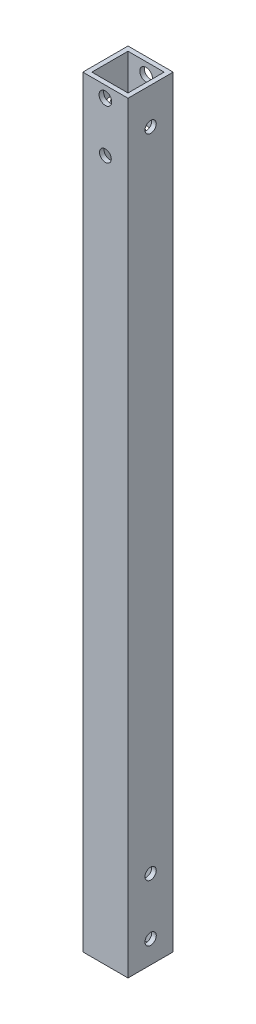
from build123d import *

# Parameters (mm, degrees)
ESBO_O1_W             = 20
ESBO_O1_H             = 20
ESBO_O1_W_2           = 16
ESBO_O1_H_2           = 16
EXTRUS_O_FINA1_DEPTH  = 337
ESBO_O2_R             = 2.5
CORTE_EXTRUS_O1_DEPTH = 339.18486069
ESBO_O3_R             = 2.6
ESBO_O3_R_2           = 2.8
CORTE_EXTRUS_O2_DEPTH = 339.18486069
ESBO_O4_R             = 2.5
CORTE_EXTRUS_O3_DEPTH = 339.18486069


with BuildPart() as part:
    # Esboço1 → Extrusão-Fina1 (new body)
    with BuildSketch(Plane(origin=(0, 0, 0), x_dir=(1, 0, 0), z_dir=(0, 1, 0))):
        with Locations((10, 10)):
            Rectangle(ESBO_O1_W, ESBO_O1_H)
        with Locations((10, 10)):
            Rectangle(ESBO_O1_W_2, ESBO_O1_H_2, mode=Mode.SUBTRACT)
    extrude(amount=EXTRUS_O_FINA1_DEPTH)

    # Esboço2 → Corte-extrusão1 (cut, through all)
    with BuildSketch(Plane.ZY):
        with Locations((-10, 35)):
            Circle(ESBO_O2_R)
        with Locations((-10, 10)):
            Circle(ESBO_O2_R)
    extrude(amount=-CORTE_EXTRUS_O1_DEPTH, mode=Mode.SUBTRACT)

    # Esboço3 → Corte-extrusão2 (cut, through all)
    with BuildSketch(Plane(origin=(0, 0, -20), x_dir=(-1, 0, 0), z_dir=(0, 0, -1))):
        with Locations((-10, 310)):
            Circle(ESBO_O3_R)
        with Locations((-10, 332)):
            Circle(ESBO_O3_R_2)
    extrude(amount=-CORTE_EXTRUS_O2_DEPTH, mode=Mode.SUBTRACT)

    # Esboço4 → Corte-extrusão3 (cut, through all)
    with BuildSketch(Plane(origin=(20, 0, 0), x_dir=(0, 0, -1), z_dir=(1, 0, 0))):
        with Locations((10, 321)):
            Circle(ESBO_O4_R)
    extrude(amount=-CORTE_EXTRUS_O3_DEPTH, mode=Mode.SUBTRACT)


solid = part.part
